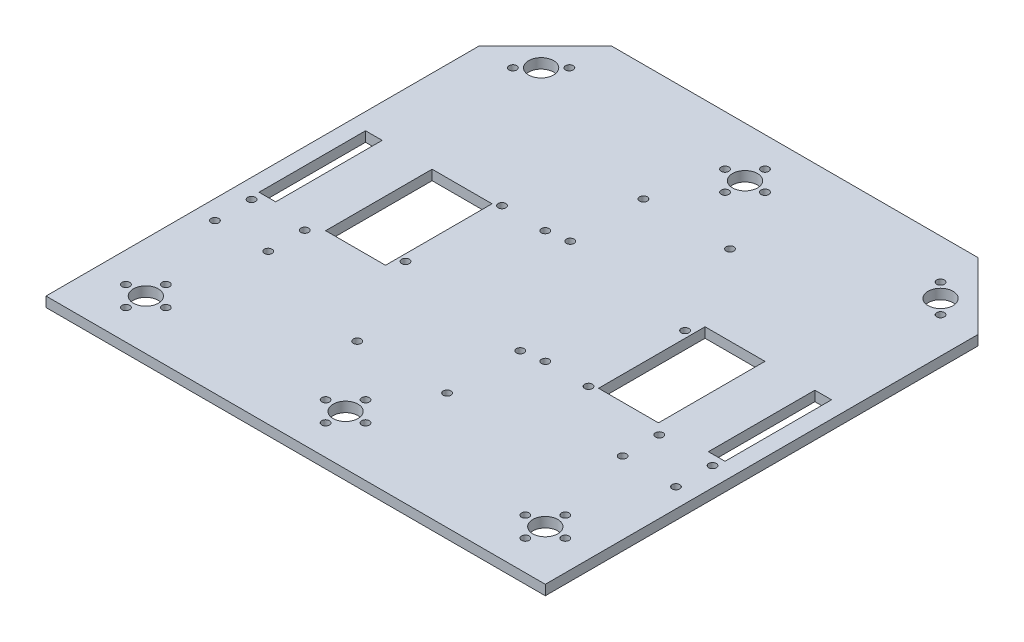
from build123d import *

# Parameters (mm, degrees)
ESQUISSE1_R              = 7.5
ESQUISSE1_R_2            = 2.3
ESQUISSE1_R_3            = 2.34
BOSS_EXTRU_1_DEPTH       = 6
ENL_V_MAT_EXTRU_9_DEPTH  = 10.5
ESQUISSE6_R              = 2.3
ENL_V_MAT_EXTRU_10_DEPTH = 50
ESQUISSE4_W              = 36
ESQUISSE4_H              = 64
ENL_V_MAT_EXTRU_11_DEPTH = 50
ESQUISSE11_R             = 2.3
ESQUISSE11_R_2           = 2.34
ENL_V_MAT_EXTRU_15_DEPTH = 10


with BuildPart() as part:
    # Esquisse1 → Boss.-Extru.1 (new body)
    with BuildSketch(Plane(origin=(0, 0, 0), x_dir=(1, 0, 0), z_dir=(0, 1, 0))):
        Polygon((-150, 0), (-150, 260), (-110, 300), (110, 300), (150, 260), (150, 0), align=None)
        with Locations(Location((-120, 30, 0), (0, 0, 270))):
            Circle(ESQUISSE1_R, mode=Mode.SUBTRACT)
        with Locations(Location((-120, 267.5, 0), (0, 0, 270))):
            Circle(ESQUISSE1_R, mode=Mode.SUBTRACT)
        with Locations(Location((120, 267.5, 0), (0, 0, 270))):
            Circle(ESQUISSE1_R, mode=Mode.SUBTRACT)
        with Locations(Location((-111.514718626, 275.985281374, 0), (0, 0, 270))):
            Circle(ESQUISSE1_R_2, mode=Mode.SUBTRACT)
        with Locations(Location((-128.485281374, 259.014718626, 0), (0, 0, 270))):
            Circle(ESQUISSE1_R_2, mode=Mode.SUBTRACT)
        with Locations(Location((111.514718626, 275.985281374, 0), (0, 0, 270))):
            Circle(ESQUISSE1_R_2, mode=Mode.SUBTRACT)
        with Locations(Location((128.485281374, 259.014718626, 0), (0, 0, 270))):
            Circle(ESQUISSE1_R_2, mode=Mode.SUBTRACT)
        with Locations(Location((120, 30, 0), (0, 0, 270))):
            Circle(ESQUISSE1_R, mode=Mode.SUBTRACT)
        with Locations(Location((120, 42, 0), (0, 0, 270))):
            Circle(ESQUISSE1_R_2, mode=Mode.SUBTRACT)
        with Locations(Location((-120, 42, 0), (0, 0, 270))):
            Circle(ESQUISSE1_R_2, mode=Mode.SUBTRACT)
        with Locations(Location((-120, 18, 0), (0, 0, 270))):
            Circle(ESQUISSE1_R_2, mode=Mode.SUBTRACT)
        with Locations(Location((-132, 30, 0), (0, 0, 270))):
            Circle(ESQUISSE1_R_2, mode=Mode.SUBTRACT)
        with Locations(Location((-108, 30, 0), (0, 0, 270))):
            Circle(ESQUISSE1_R_2, mode=Mode.SUBTRACT)
        with Locations(Location((108, 30, 0), (0, 0, 270))):
            Circle(ESQUISSE1_R_2, mode=Mode.SUBTRACT)
        with Locations(Location((132, 30, 0), (0, 0, 270))):
            Circle(ESQUISSE1_R_2, mode=Mode.SUBTRACT)
        with Locations(Location((120, 18, 0), (0, 0, 270))):
            Circle(ESQUISSE1_R_2, mode=Mode.SUBTRACT)
        with Locations(Location((0, 30, 0), (0, 0, 270))):
            Circle(ESQUISSE1_R, mode=Mode.SUBTRACT)
        with Locations(Location((0, 18, 0), (0, 0, 270))):
            Circle(ESQUISSE1_R_2, mode=Mode.SUBTRACT)
        with Locations(Location((12, 30, 0), (0, 0, 270))):
            Circle(ESQUISSE1_R_2, mode=Mode.SUBTRACT)
        with Locations(Location((0, 42, 0), (0, 0, 270))):
            Circle(ESQUISSE1_R_2, mode=Mode.SUBTRACT)
        with Locations(Location((-12, 30, 0), (0, 0, 270))):
            Circle(ESQUISSE1_R_2, mode=Mode.SUBTRACT)
        with Locations(Location((0, 270, 0), (0, 0, 270))):
            Circle(ESQUISSE1_R, mode=Mode.SUBTRACT)
        with Locations(Location((-12, 270, 0), (0, 0, 270))):
            Circle(ESQUISSE1_R_2, mode=Mode.SUBTRACT)
        with Locations(Location((0, 282, 0), (0, 0, 270))):
            Circle(ESQUISSE1_R_2, mode=Mode.SUBTRACT)
        with Locations(Location((12, 270, 0), (0, 0, 270))):
            Circle(ESQUISSE1_R_3, mode=Mode.SUBTRACT)
        with Locations(Location((0, 258, 0), (0, 0, 270))):
            Circle(ESQUISSE1_R_2, mode=Mode.SUBTRACT)
    extrude(amount=BOSS_EXTRU_1_DEPTH)

    # Esquisse7 → Enlèv. mat.-Extru.9 (cut)
    with BuildSketch(Plane(origin=(0, 6, 0), x_dir=(1, 0, 0), z_dir=(0, 1, 0))):
        Polygon((-130, 150), (-130, 182), (-140, 182), (-140, 118), (-130, 118), align=None)
    enl_v_mat_extru_9 = extrude(amount=-ENL_V_MAT_EXTRU_9_DEPTH, mode=Mode.SUBTRACT)

    # Esquisse6 → Enlèv. mat.-Extru.10 (cut)
    with BuildSketch(Plane(origin=(0, 6, 0), x_dir=(1, 0, 0), z_dir=(0, 1, 0))):
        with Locations(Location((-138.5, 90, 0), (0, 0, 270))):
            Circle(ESQUISSE6_R)
        with Locations(Location((-138.5, 112, 0), (0, 0, 270))):
            Circle(ESQUISSE6_R)
        with Locations(Location((-106.5, 112, 0), (0, 0, 270))):
            Circle(ESQUISSE6_R)
        with Locations(Location((-106.5, 90, 0), (0, 0, 270))):
            Circle(ESQUISSE6_R)
    enl_v_mat_extru_10 = extrude(amount=-ENL_V_MAT_EXTRU_10_DEPTH, mode=Mode.SUBTRACT)

    # Esquisse4 → Enlèv. mat.-Extru.11 (cut)
    with BuildSketch(Plane(origin=(0, 6, 0), x_dir=(1, 0, 0), z_dir=(0, 1, 0))):
        with Locations((-82, 150)):
            Rectangle(ESQUISSE4_W, ESQUISSE4_H)
    enl_v_mat_extru_11 = extrude(amount=-ENL_V_MAT_EXTRU_11_DEPTH, mode=Mode.SUBTRACT)

    # Symétrie1: Enlèv. mat.-Extru.9 across plane
    add(enl_v_mat_extru_9.mirror(Plane(origin=(0, 0, 0), x_dir=(0, 0, 1), z_dir=(1, 0, 0))), mode=Mode.SUBTRACT)

    # Symétrie2: Enlèv. mat.-Extru.11 across plane
    add(enl_v_mat_extru_11.mirror(Plane(origin=(0, 0, 0), x_dir=(0, 0, 1), z_dir=(1, 0, 0))), mode=Mode.SUBTRACT)

    # Symétrie3: Enlèv. mat.-Extru.10 across plane
    add(enl_v_mat_extru_10.mirror(Plane(origin=(0, 0, 0), x_dir=(0, 0, 1), z_dir=(1, 0, 0))), mode=Mode.SUBTRACT)

    # Esquisse11 → Enlèv. mat.-Extru.15 (cut)
    with BuildSketch(Plane(origin=(0, 6, 0), x_dir=(1, 0, 0), z_dir=(0, 1, 0))):
        with Locations(Location((34, 116, 0), (0, 0, 270))):
            Circle(ESQUISSE11_R)
        with Locations(Location((60, 116, 0), (0, 0, 270))):
            Circle(ESQUISSE11_R)
        with Locations(Location((60, 174, 0), (0, 0, 270))):
            Circle(ESQUISSE11_R)
        with Locations(Location((-21, 230, 0), (0, 0, 270))):
            Circle(ESQUISSE11_R)
        with Locations(Location((-21, 186, 0), (0, 0, 270))):
            Circle(ESQUISSE11_R)
        with Locations(Location((31, 230, 0), (0, 0, 270))):
            Circle(ESQUISSE11_R)
        with Locations(Location((-60, 126, 0), (0, 0, 270))):
            Circle(ESQUISSE11_R)
        with Locations(Location((-34, 184, 0), (0, 0, 270))):
            Circle(ESQUISSE11_R)
        with Locations(Location((-60, 184, 0), (0, 0, 270))):
            Circle(ESQUISSE11_R)
        with Locations(Location((-33, 70, 0), (0, 0, 270))):
            Circle(ESQUISSE11_R_2)
        with Locations(Location((21, 70, 0), (0, 0, 270))):
            Circle(ESQUISSE11_R)
        with Locations(Location((21, 114, 0), (0, 0, 270))):
            Circle(ESQUISSE11_R)
    extrude(amount=-ENL_V_MAT_EXTRU_15_DEPTH, mode=Mode.SUBTRACT)


solid = part.part
